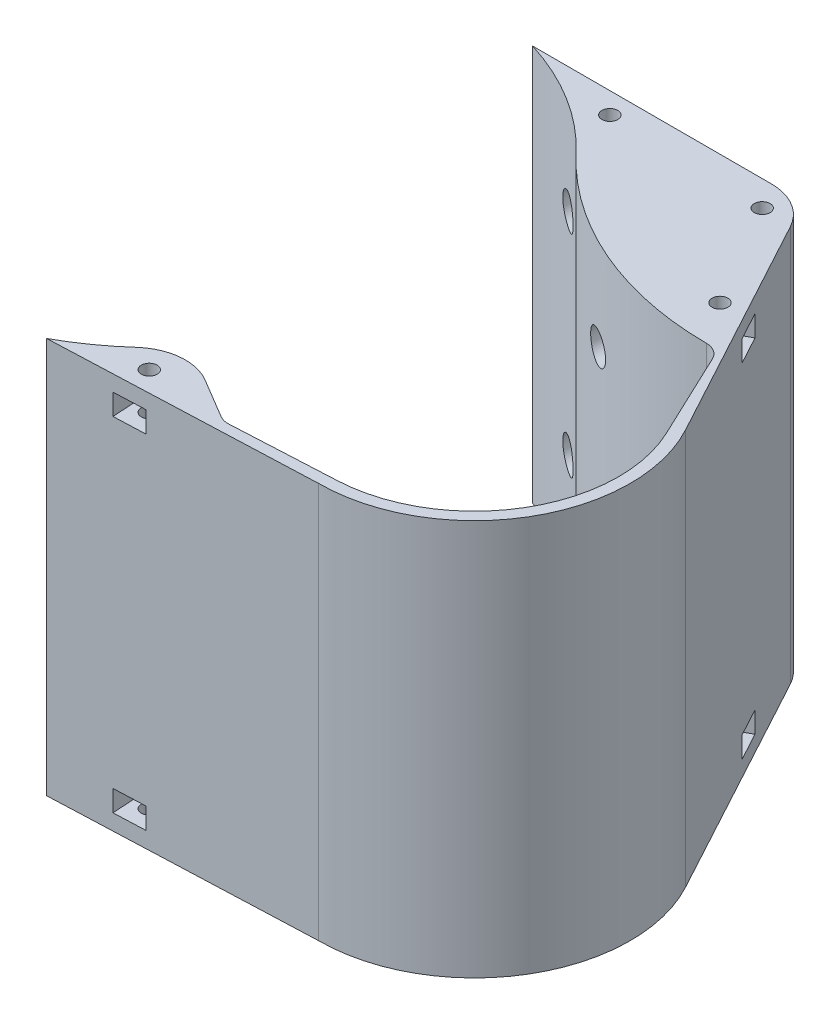
from build123d import *

# Parameters (mm, degrees)
SKETCH1_R           = 1.5
BOSS_EXTRUDE1_DEPTH = 75
FILLET1_R           = 60
FILLET2_R           = 10
CUT_EXTRUDE1_DEPTH  = 4
SKETCH4_R           = 2.9
CUT_EXTRUDE2_DEPTH  = 30


with BuildPart() as part:
    # Sketch1 → Boss-Extrude1 (new body)
    with BuildSketch(Plane(origin=(0, 0, 0), x_dir=(1, 0, 0), z_dir=(0, 1, 0))):
        with BuildLine():
            Line((56.591696316, 15.21100727), (88.688017257, 15.21100727))
            ThreePointArc((88.688017257, 15.21100727), (90.560043963, 14.668289132), (91.851509041, 13.208444991))
            Line((91.851509041, 13.208444991), (99.675235919, -3.319985773))
            ThreePointArc((99.675235919, -3.319985773), (98.430900842, -29.01009942), (76.38895534, -42.264643828))
            Line((76.38895534, -42.264643828), (56.769767513, -43.264113173))
            ThreePointArc((56.769767513, -43.264113173), (55.749067562, -43.165700148), (54.80069704, -42.775691342))
            Line((54.80069704, -42.775691342), (40.459976718, -34.234343632))
            ThreePointArc((40.459976718, -34.234343632), (33.526592489, -41.048356801), (25.465280206, -46.481388792))
            Line((25.465280206, -46.481388792), (75, -44.5))
            ThreePointArc((75, -44.5), (100.341650726, -30.101348895), (100.945295539, -0.961067014))
            Line((100.945295539, -0.961067014), (77.559049402, 42.258960334))
            ThreePointArc((77.559049402, 42.258960334), (73.883135286, 46.090390077), (68.764033965, 47.5))
            Line((68.764033965, 47.5), (23.510635891, 47.5))
            ThreePointArc((23.510635891, 47.5), (43.938112979, 35.337799568), (56.591696316, 15.21100727))
        make_face()
        with Locations(Location((71.835494757, 42.654234046, 0), (0, 0, 270))):
            Circle(SKETCH1_R, mode=Mode.SUBTRACT)
        with Locations(Location((40.293422434, -41.885064382, 0), (0, 0, 270))):
            Circle(SKETCH1_R, mode=Mode.SUBTRACT)
        with Locations(Location((42.137334928, 43.5, 0), (0, 0, 270))):
            Circle(SKETCH1_R, mode=Mode.SUBTRACT)
        with Locations(Location((83.354686129, 23.142870245, 0), (0, 0, 270))):
            Circle(SKETCH1_R, mode=Mode.SUBTRACT)
    extrude(amount=BOSS_EXTRUDE1_DEPTH)

    # Fillet1
    fillet1_edges = [part.edges().sort_by_distance(p)[0] for p in [
        (56.591696316, 37.5, -15.21100727),
    ]]
    fillet(fillet1_edges, radius=FILLET1_R)

    # Fillet2
    fillet2_edges = [part.edges().sort_by_distance(p)[0] for p in [
        (40.459976718, 37.5, 34.234343632),
    ]]
    fillet(fillet2_edges, radius=FILLET2_R)

    # Sketch3 → Cut-Extrude1 (cut)
    with BuildSketch(Plane(origin=(0, 72, 0), x_dir=(1, 0, 0), z_dir=(0, 1, 0))):
        with BuildLine():
            Line((39.137334928, 43.5), (39.137334928, 48.914062906))
            Line((39.137334928, 48.914062906), (45.137334928, 48.914062906))
            Line((45.137334928, 48.914062906), (45.137334928, 43.5))
            ThreePointArc((45.137334928, 43.5), (42.137334928, 40.5), (39.137334928, 43.5))
        make_face()
        with BuildLine():
            Line((74.41261178, 41.11850365), (77.272251707, 45.917280019))
            Line((77.272251707, 45.917280019), (72.118017661, 48.988740812))
            Line((72.118017661, 48.988740812), (69.258377734, 44.189964442))
            ThreePointArc((69.258377734, 44.189964442), (70.299764361, 40.077117023), (74.41261178, 41.11850365))
        make_face()
        with BuildLine():
            Line((81.936736501, 25.786621151), (87.421531644, 28.728336732))
            Line((87.421531644, 28.728336732), (90.2574309, 23.44083492))
            Line((90.2574309, 23.44083492), (84.772635757, 20.499119339))
            ThreePointArc((84.772635757, 20.499119339), (80.710935223, 21.724920617), (81.936736501, 25.786621151))
        make_face()
        with BuildLine():
            Line((37.298688778, -42.062744804), (37.612282879, -47.348250065))
            Line((37.612282879, -47.348250065), (43.60175019, -46.99288922))
            Line((43.60175019, -46.99288922), (43.288156089, -41.707383959))
            ThreePointArc((43.288156089, -41.707383959), (40.115742012, -38.890330726), (37.298688778, -42.062744804))
        make_face()
    cut_extrude1 = extrude(amount=-CUT_EXTRUDE1_DEPTH, mode=Mode.SUBTRACT)

    # Mirror1: Cut-Extrude1 across plane
    add(cut_extrude1.mirror(Plane.ZX.offset(37.5)), mode=Mode.SUBTRACT)

    # Sketch4 → Cut-Extrude2 (cut)
    with BuildSketch(Plane(origin=(0, 0, -47.5), x_dir=(-1, 0, 0), z_dir=(0, 0, -1))):
        with Locations((-61.510635891, 57.5)):
            Circle(SKETCH4_R)
        with Locations((-36.510635891, 57.5)):
            Circle(SKETCH4_R)
        with Locations((-36.510635891, 17.5)):
            Circle(SKETCH4_R)
        with Locations((-61.510635891, 17.5)):
            Circle(SKETCH4_R)
    extrude(amount=-CUT_EXTRUDE2_DEPTH, mode=Mode.SUBTRACT)


solid = part.part
